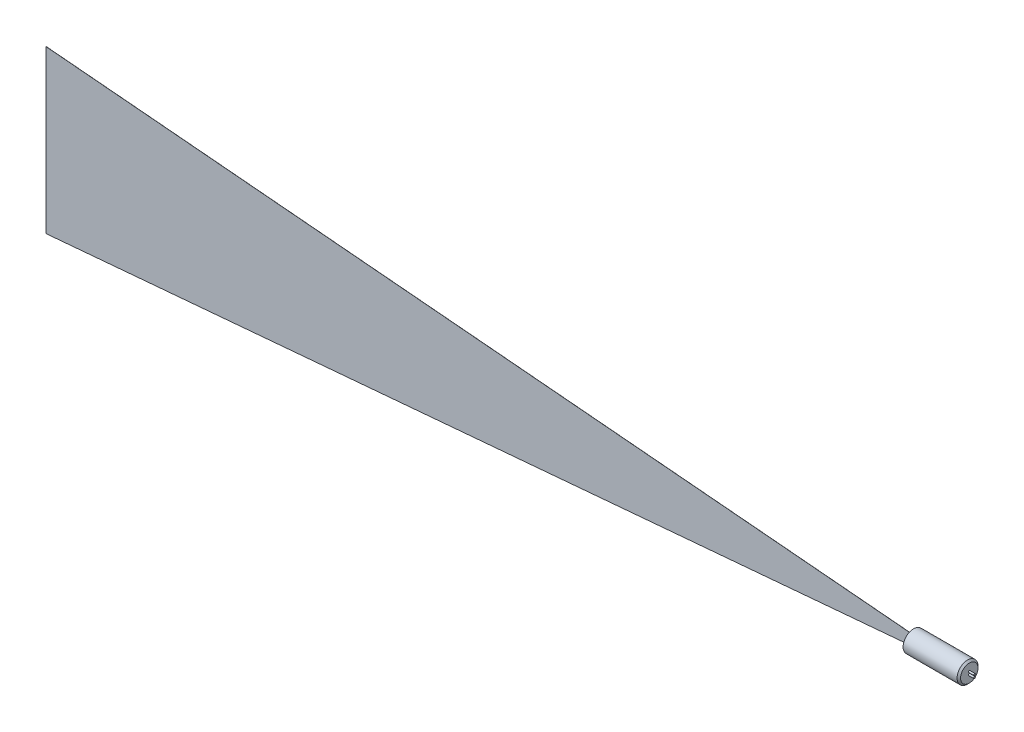
from build123d import *

# Parameters (mm, degrees)
ESQUISSE1_R             = 6
EXTRUSION1_DEPTH        = 32
ESQUISSE2_R             = 3.4
ENL_V_MAT_EXTRU_1_DEPTH = 2
CHANFREIN1_SIZE         = 1
ESQUISSE3_R             = 0.5
EXTRUSION2_DEPTH        = 3
EXTRUSION3_DEPTH        = 0.05


with BuildPart() as part:
    # Esquisse1 → Extrusion1 (new body)
    with BuildSketch(Plane(origin=(0, 0, 0), x_dir=(0, 0, -1), z_dir=(1, 0, 0))):
        Circle(ESQUISSE1_R)
    extrude(amount=EXTRUSION1_DEPTH)

    # Esquisse2 → Enlèv. mat.-Extru.1 (cut)
    with BuildSketch(Plane.ZY):
        Circle(ESQUISSE2_R)
    extrude(amount=-ENL_V_MAT_EXTRU_1_DEPTH, mode=Mode.SUBTRACT)

    # Chanfrein1
    chanfrein1_edges = [part.edges().sort_by_distance(p)[0] for p in [
        (32, 0, 6),
    ]]
    chamfer(chanfrein1_edges, length=CHANFREIN1_SIZE)

    # Esquisse3 → Extrusion2 (add)
    with BuildSketch(Plane(origin=(32, 0, 0), x_dir=(0, 0, -1), z_dir=(1, 0, 0))):
        with Locations((0, 0.75)):
            Circle(ESQUISSE3_R)
        with Locations(Location((0, -0.75, 0), (0, 0, 180))):
            Circle(ESQUISSE3_R)
    extrude(amount=EXTRUSION2_DEPTH)

    # Esquisse4 → Extrusion3 (add, symmetric)
    with BuildSketch(Plane.XY):
        Polygon((2, 2.75), (2, -2.75), (-498, -46.494331763), (-498, 46.494331763), align=None)
    extrude(amount=EXTRUSION3_DEPTH, both=True)


solid = part.part
